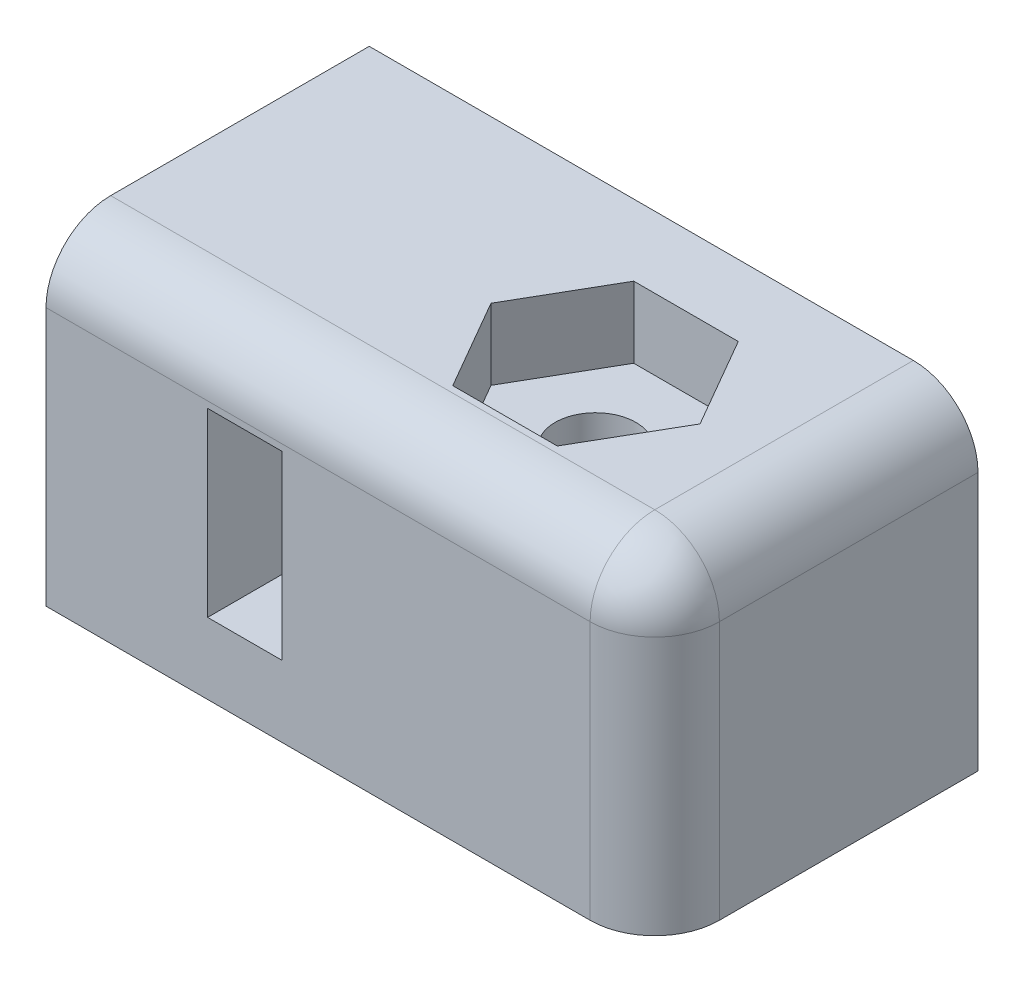
from build123d import *

# Parameters (mm, degrees)
SKETCH1_W           = 74.5
SKETCH1_H           = 10
BOSS_EXTRUDE1_DEPTH = 10
SKETCH2_R           = 1.25
CUT_EXTRUDE1_DEPTH  = 10
SKETCH4_R           = 1.25
CUT_EXTRUDE3_DEPTH  = 5
CUT_EXTRUDE4_START  = -12
SKETCH5_R           = 1.25
CUT_EXTRUDE4_DEPTH  = 12
CUT_EXTRUDE5_DEPTH  = 2.2
CUT_EXTRUDE6_DEPTH  = 2.2
SKETCH11_W          = 2.3
SKETCH11_H          = 5.6
CUT_EXTRUDE9_DEPTH  = 7.3
SKETCH12_W          = 92.79599186
SKETCH12_H          = 35.188487641
CUT_EXTRUDE10_DEPTH = 14
SKETCH13_W          = 8.109024166
SKETCH13_H          = 12.314563919
CUT_EXTRUDE11_DEPTH = 12
FILLET2_R           = 2
FILLET3_R           = 2


with BuildPart() as part:
    # Sketch1 → Boss-Extrude1 (new body)
    with BuildSketch(Plane(origin=(0, 0, 0), x_dir=(1, 0, 0), z_dir=(0, 1, 0))):
        with Locations((37.25, 5)):
            Rectangle(SKETCH1_W, SKETCH1_H)
    extrude(amount=BOSS_EXTRUDE1_DEPTH)

    # Sketch2 → Cut-Extrude1 (cut)
    with BuildSketch(Plane(origin=(0, 10, 0), x_dir=(1, 0, 0), z_dir=(0, 1, 0))):
        with Locations(Location((12, 5, 0), (0, 0, 270))):
            Circle(SKETCH2_R)
        with Locations(Location((62.5, 5, 0), (0, 0, 270))):
            Circle(SKETCH2_R)
    extrude(amount=-CUT_EXTRUDE1_DEPTH, mode=Mode.SUBTRACT)

    # Sketch4 → Cut-Extrude3 (cut)
    with BuildSketch(Plane(origin=(74.5, 0, 0), x_dir=(0, 0, -1), z_dir=(1, 0, 0))):
        with Locations((5, 5)):
            Circle(SKETCH4_R)
    extrude(amount=-CUT_EXTRUDE3_DEPTH, mode=Mode.SUBTRACT)

    # Sketch5 → Cut-Extrude4 (cut)
    with BuildSketch(Plane.ZY.offset(CUT_EXTRUDE4_START)):
        with Locations(Location((-5, 5, 0), (0, 0, 180))):
            Circle(SKETCH5_R)
    extrude(amount=CUT_EXTRUDE4_DEPTH, mode=Mode.SUBTRACT)

    # Sketch6 → Cut-Extrude5 (cut)
    with BuildSketch(Plane(origin=(0, 10, 0), x_dir=(1, 0, 0), z_dir=(0, 1, 0))):
        Polygon((13.616580754, 2.2), (15.233161507, 5), (13.616580754, 7.8), (10.383419246, 7.8), (8.766838493, 5), (10.383419246, 2.2), align=None)
    extrude(amount=-CUT_EXTRUDE5_DEPTH, mode=Mode.SUBTRACT)

    # Sketch7 → Cut-Extrude6 (cut)
    with BuildSketch(Plane(origin=(0, 10, 0), x_dir=(1, 0, 0), z_dir=(0, 1, 0))):
        Polygon((60.883419246, 7.8), (59.266838493, 5), (60.883419246, 2.2), (64.116580754, 2.2), (65.733161507, 5), (64.116580754, 7.8), align=None)
    extrude(amount=-CUT_EXTRUDE6_DEPTH, mode=Mode.SUBTRACT)

    # Sketch11 → Cut-Extrude9 (cut)
    with BuildSketch(Plane.XY):
        with Locations((6.15, 5)):
            Rectangle(SKETCH11_W, SKETCH11_H)
        with Locations((68.35, 5)):
            Rectangle(SKETCH11_W, SKETCH11_H)
    extrude(amount=-CUT_EXTRUDE9_DEPTH, mode=Mode.SUBTRACT)

    # Sketch12 → Cut-Extrude10 (cut)
    with BuildSketch(Plane.XY):
        with Locations((72.539564665, 12.110455679)):
            Rectangle(SKETCH12_W, SKETCH12_H)
    extrude(amount=-CUT_EXTRUDE10_DEPTH, mode=Mode.SUBTRACT)

    # Sketch13 → Cut-Extrude11 (cut)
    with BuildSketch(Plane(origin=(0, 10, 0), x_dir=(1, 0, 0), z_dir=(0, 1, 0))):
        with Locations((22.887582964, 5.058087566)):
            Rectangle(SKETCH13_W, SKETCH13_H)
    extrude(amount=-CUT_EXTRUDE11_DEPTH, mode=Mode.SUBTRACT)

    # Fillet2
    fillet2_edges = [part.edges().sort_by_distance(p)[0] for p in [
        (18.833070881, 5, 0),
    ]]
    fillet(fillet2_edges, radius=FILLET2_R)

    # Fillet3
    fillet3_edges = [part.edges().sort_by_distance(p)[0] for p in [
        (18.833070881, 10, -6),
        (18.247284443, 10, -0.585786438),
        (8.416535441, 10, 0),
    ]]
    fillet(fillet3_edges, radius=FILLET3_R)


solid = part.part
